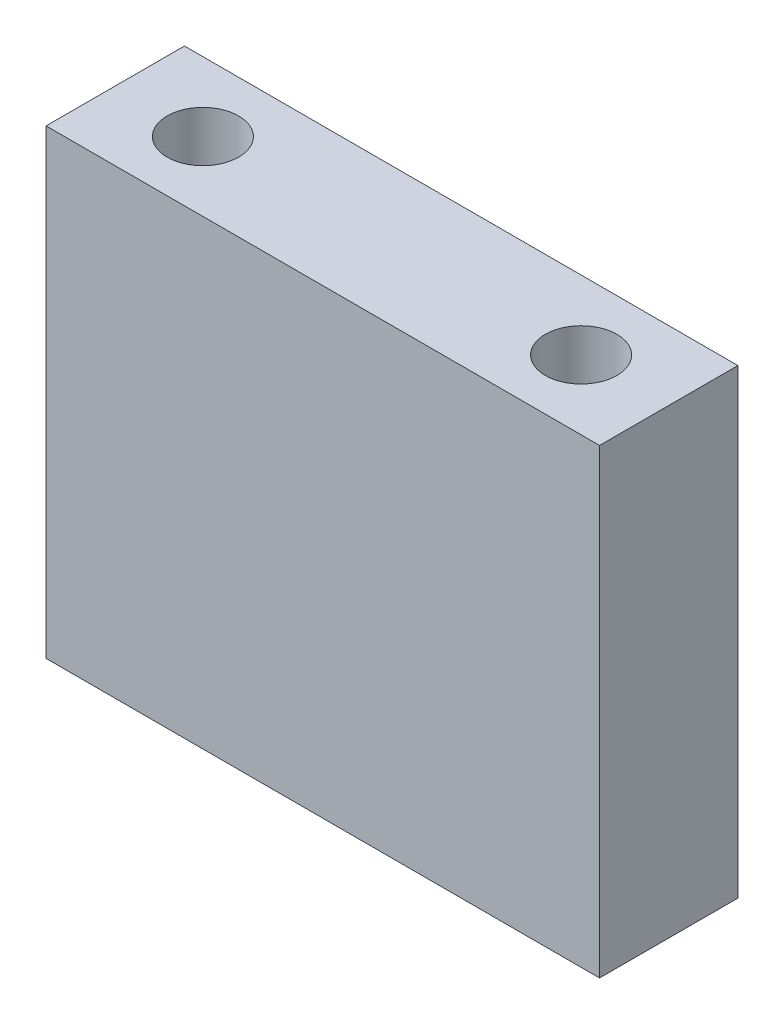
from build123d import *

# Parameters (mm, degrees)
SKETCH_1_W          = 120
SKETCH_1_H          = 30
EXTRUDE_1_DEPTH     = 100
SKETCH_2_R          = 7.75
CUT_EXTRUDE_1_DEPTH = 1000


with BuildPart() as part:
    # 스케치1 → 보스-돌출1 (new body)
    with BuildSketch(Plane(origin=(0, 0, 0), x_dir=(1, 0, 0), z_dir=(0, 1, 0))):
        with Locations((60, 15)):
            Rectangle(SKETCH_1_W, SKETCH_1_H)
    extrude(amount=EXTRUDE_1_DEPTH)

    # 스케치2 → 컷-돌출1 (cut)
    with BuildSketch(Plane(origin=(0, 100, 0), x_dir=(1, 0, 0), z_dir=(0, 1, 0))):
        with Locations(Location((101, 15, 0), (0, 0, 270))):
            Circle(SKETCH_2_R)
        with Locations(Location((19, 15, 0), (0, 0, 270))):
            Circle(SKETCH_2_R)
    extrude(amount=-CUT_EXTRUDE_1_DEPTH, mode=Mode.SUBTRACT)


solid = part.part
